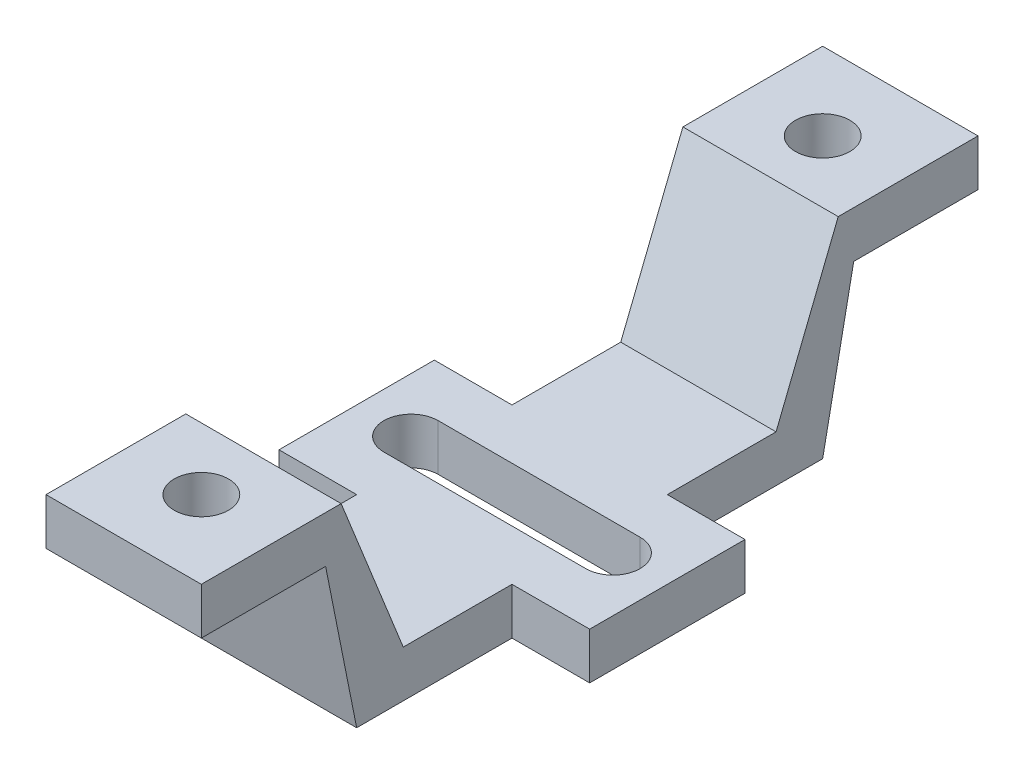
from build123d import *

# Parameters (mm, degrees)
SKETCH_1_W          = 20
SKETCH_1_H          = 10
EXTRUDE_1_DEPTH     = 3
SKETCH_2_W          = 8
SKETCH_2_H          = 3
EXTRUDE_2_DEPTH     = 5
SKETCH_3_R          = 1.75
CUT_EXTRUDE_1_DEPTH = 10


with BuildPart() as part:
    # 草图1 → 凸台-拉伸1 (new body)
    with BuildSketch(Plane(origin=(0, 0, 0), x_dir=(1, 0, 0), z_dir=(0, 1, 0))):
        Rectangle(SKETCH_1_W, SKETCH_1_H)
        with BuildLine():
            ThreePointArc((-6.5, -1.75), (-8.25, 0), (-6.5, 1.75))
            Line((-6.5, 1.75), (6.5, 1.75))
            ThreePointArc((6.5, 1.75), (7.737436867, 1.237436867), (8.25, 0))
            ThreePointArc((8.25, 0), (7.737436867, -1.237436867), (6.5, -1.75))
            Line((6.5, -1.75), (-6.5, -1.75))
        make_face(mode=Mode.SUBTRACT)
    extrude(amount=EXTRUDE_1_DEPTH)

    # 草图2 → 凸台-拉伸2 (add, symmetric)
    with BuildSketch(Plane(origin=(0, 0, 0), x_dir=(0, 0, -1), z_dir=(1, 0, 0))):
        with Locations((-21, 11.5)):
            Rectangle(SKETCH_2_W, SKETCH_2_H)
        Polygon((-12, 3), (-5, 3), (-5, 0), (-15, 0), (-17, 10), (-17, 13), (-16, 13), align=None)
        Polygon((16, 13), (17, 13), (17, 10), (15, 0), (5, 0), (5, 3), (12, 3), align=None)
        with Locations((21, 11.5)):
            Rectangle(SKETCH_2_W, SKETCH_2_H)
    extrude(amount=EXTRUDE_2_DEPTH, both=True)

    # 草图3 → 切除-拉伸1 (cut)
    with BuildSketch(Plane(origin=(0, 13, 0), x_dir=(1, 0, 0), z_dir=(0, 1, 0))):
        with Locations(Location((0, 20, 0), (0, 0, 270))):
            Circle(SKETCH_3_R)
        with Locations(Location((0, -20, 0), (0, 0, 270))):
            Circle(SKETCH_3_R)
    extrude(amount=-CUT_EXTRUDE_1_DEPTH, mode=Mode.SUBTRACT)


solid = part.part
